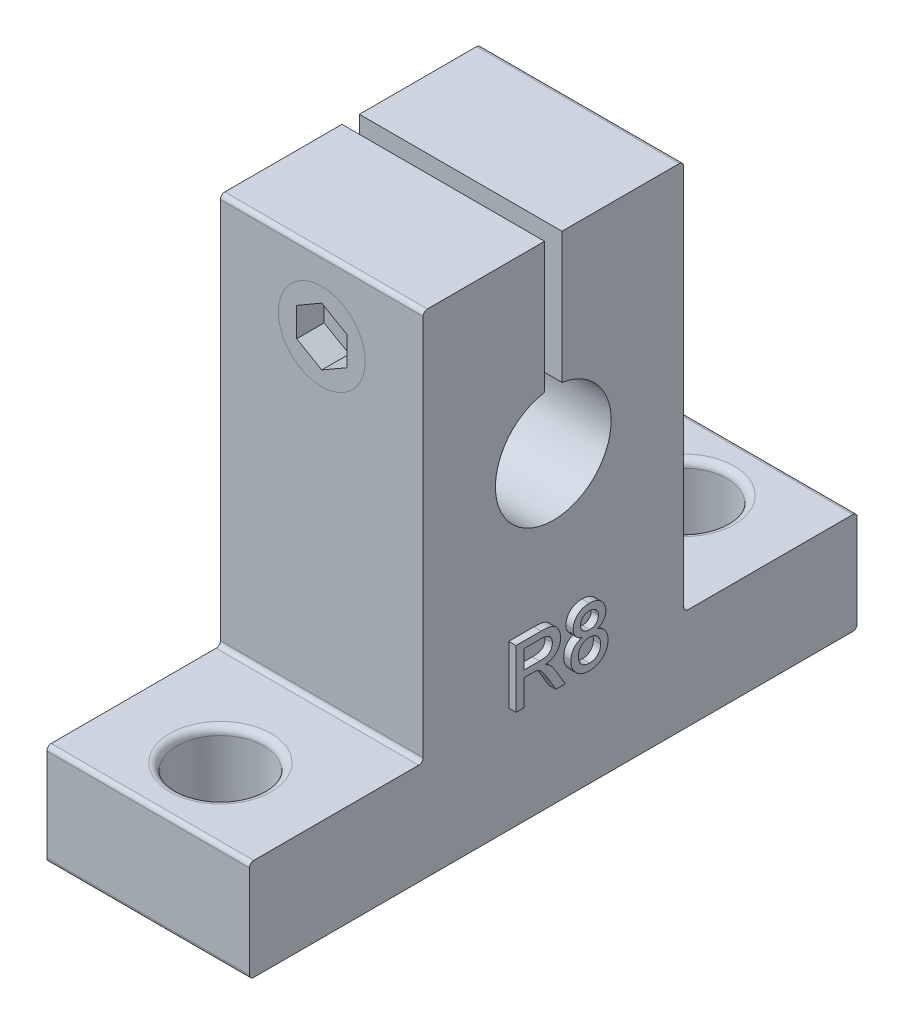
from build123d import *

# Parameters (mm, degrees)
SKETCH_1_R               = 4
EXTRUDE_1_DEPTH          = 14
CUT_EXTRUDE_1_DEPTH      = 56.821142948
CUT_EXTRUDE_1_DEPTH_BACK = 14
SKETCH_2_W               = 1.2
SKETCH_2_H               = 13
SKETCH_3_R               = 3
CUT_EXTRUDE_1_2_DEPTH    = 14
SKETCH_4_R               = 2
CUT_EXTRUDE_2_DEPTH      = 24
SKETCH_5_R               = 3
CUT_EXTRUDE_3_DEPTH      = 5
EXTRUDE_2_DEPTH          = 0.1
EXTRUDE_2_DEPTH_BACK     = 15
SKETCH_6_R               = 2
FILLET_1_R               = 0.5
SKETCH_7_R               = 3
EXTRUDE_3_DEPTH          = 5
FILLET_2_R               = 0.5
FILLET_3_R               = 0.5
EXTRUDE_4_DEPTH          = 0.5


with BuildPart() as part:
    # Эскиз1 → Бобышка-Вытянуть1 (new body)
    with BuildSketch(Plane(origin=(0, 0, 0), x_dir=(0, 0, -1), z_dir=(1, 0, 0))):
        with BuildLine():
            Line((0.3, 7), (11.7, 7))
            ThreePointArc((11.7, 7), (11.912132034, 7.087867966), (12, 7.3))
            Line((12, 7.3), (12, 33.7))
            ThreePointArc((12, 33.7), (12.087867966, 33.912132034), (12.3, 34))
            Line((12.3, 34), (29.7, 34))
            ThreePointArc((29.7, 34), (29.912132034, 33.912132034), (30, 33.7))
            Line((30, 33.7), (30, 7.3))
            ThreePointArc((30, 7.3), (30.087867966, 7.087867966), (30.3, 7))
            Line((30.3, 7), (41.7, 7))
            ThreePointArc((41.7, 7), (41.912132034, 6.912132034), (42, 6.7))
            Line((42, 6.7), (42, 0.3))
            ThreePointArc((42, 0.3), (41.912132034, 0.087867966), (41.7, 0))
            Line((41.7, 0), (0.3, 0))
            ThreePointArc((0.3, 0), (0.087867966, 0.087867966), (0, 0.3))
            Line((0, 0.3), (0, 6.7))
            ThreePointArc((0, 6.7), (0.087867966, 6.912132034), (0.3, 7))
        make_face()
        with Locations((21, 21)):
            Circle(SKETCH_1_R, mode=Mode.SUBTRACT)
    extrude(amount=EXTRUDE_1_DEPTH)

    # Эскиз2 → Cut-Extrude 1 (cut, two sides: drawn at the far end of the back side and taken through both)
    with BuildSketch(Plane(origin=(14, 0, 0), x_dir=(0, 0, -1), z_dir=(1, 0, 0)).offset(-CUT_EXTRUDE_1_DEPTH_BACK)):
        with Locations((21, 27.5)):
            Rectangle(SKETCH_2_W, SKETCH_2_H)
    extrude(amount=CUT_EXTRUDE_1_DEPTH + CUT_EXTRUDE_1_DEPTH_BACK, mode=Mode.SUBTRACT)

    # Эскиз3 → Cut-Extrude 1 2 (cut)
    with BuildSketch(Plane(origin=(0, 7, 0), x_dir=(1, 0, 0), z_dir=(0, 1, 0))):
        with Locations(Location((7, 5, 0), (0, 0, 270))):
            Circle(SKETCH_3_R)
        with Locations(Location((7, 37, 0), (0, 0, 270))):
            Circle(SKETCH_3_R)
    extrude(amount=-CUT_EXTRUDE_1_2_DEPTH, mode=Mode.SUBTRACT)

    # Эскиз4 → Вырез-Вытянуть2 (cut)
    with BuildSketch(Plane.XY.offset(-12)):
        with Locations((7, 29)):
            Circle(SKETCH_4_R)
    extrude(amount=-CUT_EXTRUDE_2_DEPTH, mode=Mode.SUBTRACT)

    # Эскиз5 → Вырез-Вытянуть3 (cut)
    with BuildSketch(Plane.XY.offset(-12)):
        with Locations((7, 29)):
            Circle(SKETCH_5_R)
    extrude(amount=-CUT_EXTRUDE_3_DEPTH, mode=Mode.SUBTRACT)

    # Скругление1
    fillet_1_edges = [part.edges().sort_by_distance(p)[0] for p in [
        (5, 29, -30),
    ]]
    fillet(fillet_1_edges, radius=FILLET_1_R)

    # Скругление2
    fillet_2_edges = [part.edges().sort_by_distance(p)[0] for p in [
        (7, 7, -8),
    ]]
    fillet(fillet_2_edges, radius=FILLET_2_R)

    # Скругление3
    fillet_3_edges = [part.edges().sort_by_distance(p)[0] for p in [
        (7, 7, -40),
    ]]
    fillet(fillet_3_edges, radius=FILLET_3_R)

    # Эскиз8 → Бобышка-Вытянуть4 (add)
    # profile 1 of 2: a face of its own
    with BuildSketch(Plane(origin=(14, 0, 0), x_dir=(0, 0, -1), z_dir=(1, 0, 0))):
        with BuildLine():
            Line((17.923076923, 7.3), (17.923076923, 11.3))
            Line((17.923076923, 11.3), (19.658653846, 11.3))
            add(Edge.make_bspline(
                [(19.658653846, 11.3), (19.699521368, 11.299679786), (19.778615674, 11.299060049), (19.893318749, 11.294673018), (20.00038257, 11.285215729), (20.100003993, 11.274988989), (20.192165317, 11.259292309), (20.276771462, 11.241288572), (20.353953055, 11.219863853), (20.424055146, 11.194559608), (20.4890946, 11.165931645), (20.549381261, 11.130609361), (20.607421168, 11.091903669), (20.661060257, 11.046430258), (20.711713265, 10.996641081), (20.759333246, 10.941859611), (20.803215222, 10.881610454), (20.857338384, 10.795381416), (20.915401502, 10.680542495), (20.9637772, 10.53357356), (20.994968984, 10.37983869), (20.998306594, 10.274778715), (21, 10.221474359)],
                knots=[0, 0, 0, 0, 1.242255013, 2.404239178, 3.487702428, 4.508875116, 5.447164253, 6.327763259, 7.137389581, 7.87956647, 8.591787438, 9.293660819, 10.000726923, 10.709654955, 11.427269343, 12.158170644, 12.913245971, 13.690346794, 15.251572448, 16.809945773, 18.381459854, 20, 20, 20, 20], degree=3))
            add(Edge.make_bspline(
                [(21, 10.221474359), (20.999217269, 10.187257716), (20.997671323, 10.1196775), (20.985829218, 10.020316493), (20.964401885, 9.925381047), (20.936925554, 9.834039733), (20.899318838, 9.747586712), (20.855753091, 9.664256155), (20.801781324, 9.586337375), (20.741353962, 9.511755519), (20.672059983, 9.442107932), (20.593289808, 9.379907326), (20.505824269, 9.323957758), (20.409251438, 9.275802895), (20.304682964, 9.231787065), (20.190806802, 9.196343398), (20.068082545, 9.167400926), (19.983004386, 9.153385864), (19.939102564, 9.146153846)],
                knots=[0, 0, 0, 0, 0.982609109, 1.940720374, 2.867584677, 3.775009516, 4.675469332, 5.571146231, 6.471115823, 7.392408543, 8.32534739, 9.286126426, 10.269214477, 11.301811357, 12.381622301, 13.524260118, 14.722474812, 16, 16, 16, 16], degree=3))
            add(Edge.make_bspline(
                [(19.939102564, 9.146153846), (19.971306214, 9.129885273), (20.032462104, 9.098990666), (20.117133191, 9.050548191), (20.188905941, 9.001051919), (20.230487532, 8.96565073), (20.25, 8.949038462)],
                knots=[0, 0, 0, 0, 1.172304973, 2.226249348, 3.167654437, 4, 4, 4, 4], degree=3))
            add(Edge.make_bspline(
                [(20.25, 8.949038462), (20.287786997, 8.911996162), (20.365404172, 8.835908648), (20.472364011, 8.706309322), (20.576065249, 8.562045386), (20.639071569, 8.457785351), (20.671474359, 8.404166667)],
                knots=[0, 0, 0, 0, 0.918110279, 1.885863737, 2.912745394, 4, 4, 4, 4], degree=3))
            Line((20.671474359, 8.404166667), (21.327724359, 7.3))
            Line((21.327724359, 7.3), (20.681089744, 7.3))
            Line((20.681089744, 7.3), (20.182692308, 8.144551282))
            add(Edge.make_bspline(
                [(20.182692308, 8.144551282), (20.164772439, 8.174183379), (20.130046677, 8.231605517), (20.079886557, 8.315467786), (20.030706209, 8.392676366), (19.985092277, 8.465437921), (19.941193672, 8.532431501), (19.899434556, 8.593889829), (19.860964161, 8.650619156), (19.813313602, 8.716666857), (19.757856265, 8.789749251), (19.693141359, 8.865010316), (19.631513581, 8.925014961), (19.555617835, 8.983855898), (19.461609471, 9.038891704), (19.381700587, 9.064179145), (19.342948718, 9.076442308)],
                knots=[0, 0, 0, 0, 1.130940588, 2.191577161, 3.191089816, 4.120344442, 4.99615009, 5.80661983, 6.546979556, 7.234477901, 8.466216387, 9.541989141, 10.473533583, 11.269175393, 12.675684693, 14, 14, 14, 14], degree=3))
            add(Edge.make_bspline(
                [(19.342948718, 9.076442308), (19.32668987, 9.079374331), (19.289570432, 9.086068227), (19.22654172, 9.090440021), (19.150174703, 9.095080096), (19.094830224, 9.094944899), (19.064903846, 9.094871795)],
                knots=[0, 0, 0, 0, 0.709978628, 1.620902492, 2.713552433, 4, 4, 4, 4], degree=3))
            Line((19.064903846, 9.094871795), (18.487179487, 9.094871795))
            Line((18.487179487, 9.094871795), (18.487179487, 7.3))
            Line((18.487179487, 7.3), (17.923076923, 7.3))
        make_face()
        with BuildLine():
            Line((18.487179487, 9.556410256), (19.55849359, 9.556410256))
            add(Edge.make_bspline(
                [(19.55849359, 9.556410256), (19.612213337, 9.557250753), (19.712637365, 9.558821982), (19.853064483, 9.572238628), (19.972739631, 9.593558247), (20.074028619, 9.624655409), (20.159127356, 9.667828597), (20.233139345, 9.720443194), (20.294644239, 9.786348453), (20.345809958, 9.860708507), (20.385582121, 9.942538035), (20.414271862, 10.028487956), (20.433049797, 10.117835918), (20.434939816, 10.178644903), (20.435897436, 10.209455128)],
                knots=[0, 0, 0, 0, 1.546323217, 2.890706218, 4.056530419, 5.041445823, 5.928701482, 6.793137403, 7.641659452, 8.509781392, 9.383301667, 10.251423607, 11.114044887, 12, 12, 12, 12], degree=3))
            add(Edge.make_bspline(
                [(20.435897436, 10.209455128), (20.435152926, 10.231907711), (20.433694651, 10.275885724), (20.426049887, 10.340433237), (20.411186652, 10.401768295), (20.391559786, 10.46021512), (20.365334311, 10.515345632), (20.334179516, 10.567587031), (20.297002227, 10.616649775), (20.254417783, 10.662683315), (20.205523102, 10.704569339), (20.149673881, 10.740707892), (20.087310601, 10.771417866), (20.018360773, 10.795791354), (19.943041602, 10.815286177), (19.860924314, 10.828255454), (19.772384447, 10.83763998), (19.711031453, 10.838182569), (19.679487179, 10.838461538)],
                knots=[0, 0, 0, 0, 0.965208469, 1.890559848, 2.786986821, 3.67262109, 4.535197034, 5.405224191, 6.282113641, 7.175449223, 8.095446547, 9.040936516, 10.026471658, 11.075712529, 12.17809725, 13.364958037, 14.645208957, 16, 16, 16, 16], degree=3))
            Line((19.679487179, 10.838461538), (18.487179487, 10.838461538))
            Line((18.487179487, 10.838461538), (18.487179487, 9.556410256))
        make_face(mode=Mode.SUBTRACT)
    # profile 2 of 2: a face of its own
    with BuildSketch(Plane(origin=(14, 0, 0), x_dir=(0, 0, -1), z_dir=(1, 0, 0))):
        with BuildLine():
            add(Edge.make_bspline(
                [(22.477564103, 9.493910256), (22.428906491, 9.512945389), (22.335613715, 9.549442052), (22.209785813, 9.622482146), (22.103292606, 9.706505156), (22.017441691, 9.803537241), (21.952007686, 9.911572483), (21.904892615, 10.029233436), (21.877296492, 10.157175602), (21.873664523, 10.245644314), (21.871794872, 10.291185897)],
                knots=[0, 0, 0, 0, 1.16287356, 2.229614231, 3.228817875, 4.173350329, 5.100165549, 6.029633206, 6.985702163, 8, 8, 8, 8], degree=3))
            add(Edge.make_bspline(
                [(21.871794872, 10.291185897), (21.872674829, 10.326228138), (21.874402214, 10.395017151), (21.889327207, 10.495953381), (21.913231735, 10.592675543), (21.947157852, 10.684910647), (21.989661717, 10.773417872), (22.043294426, 10.856575728), (22.104941895, 10.936734422), (22.177158974, 11.010653698), (22.256740948, 11.0783566), (22.342940644, 11.138605534), (22.436417665, 11.187874514), (22.535613483, 11.229067534), (22.641018571, 11.261317312), (22.753004223, 11.283281208), (22.871175665, 11.297251876), (22.952149544, 11.299069692), (22.993589744, 11.3)],
                knots=[0, 0, 0, 0, 0.994101948, 1.951453197, 2.889123786, 3.817215529, 4.736003873, 5.669743943, 6.620499649, 7.601567446, 8.596478358, 9.582687259, 10.579761808, 11.589151689, 12.62747492, 13.702346593, 14.8241243, 16, 16, 16, 16], degree=3))
            add(Edge.make_bspline(
                [(22.993589744, 11.3), (23.035294004, 11.299060246), (23.116529199, 11.297229712), (23.235328462, 11.283446756), (23.348020816, 11.260345664), (23.454539914, 11.227571029), (23.555053686, 11.185666686), (23.648901658, 11.134160747), (23.737049936, 11.073902709), (23.817245482, 11.004173975), (23.890213869, 10.928471244), (23.953434085, 10.847367996), (24.007656052, 10.762756721), (24.052462361, 10.674123384), (24.085610237, 10.580458689), (24.11087636, 10.483527323), (24.125531883, 10.382177553), (24.127302929, 10.313401184), (24.128205128, 10.278365385)],
                knots=[0, 0, 0, 0, 1.171211919, 2.281388661, 3.353996503, 4.398126828, 5.406889753, 6.407389155, 7.400009931, 8.40008733, 9.387021643, 10.349004252, 11.283445052, 12.206096336, 13.131640667, 14.068727932, 15.016178647, 16, 16, 16, 16], degree=3))
            add(Edge.make_bspline(
                [(24.128205128, 10.278365385), (24.126739533, 10.234393423), (24.123865776, 10.148172678), (24.094580907, 10.023884758), (24.048937934, 9.907855754), (23.982970065, 9.80229698), (23.899424213, 9.706118248), (23.795750473, 9.622509022), (23.673523319, 9.549583078), (23.582586038, 9.512967412), (23.53525641, 9.493910256)],
                knots=[0, 0, 0, 0, 0.998680737, 1.958225066, 2.887911823, 3.823713378, 4.77537694, 5.772726054, 6.840782926, 8, 8, 8, 8], degree=3))
            add(Edge.make_bspline(
                [(23.53525641, 9.493910256), (23.565118333, 9.483773549), (23.623634746, 9.463909999), (23.706359495, 9.425289138), (23.78424236, 9.383646681), (23.85772253, 9.338568697), (23.924087672, 9.286702843), (23.985551922, 9.231115732), (24.041856857, 9.171024032), (24.092233411, 9.105916656), (24.137209413, 9.037160099), (24.175712441, 8.964586727), (24.208412323, 8.889229528), (24.236358768, 8.810739056), (24.256771437, 8.728562434), (24.271053908, 8.643077307), (24.280115734, 8.554734211), (24.281399391, 8.49473351), (24.282051282, 8.464262821)],
                knots=[0, 0, 0, 0, 1.104208047, 2.163768705, 3.193778962, 4.198696312, 5.179575955, 6.14024585, 7.100368562, 8.060719304, 9.021161243, 9.975749006, 10.935506756, 11.897452199, 12.89163552, 13.897859372, 14.932451246, 16, 16, 16, 16], degree=3))
            add(Edge.make_bspline(
                [(24.282051282, 8.464262821), (24.281032161, 8.422265957), (24.279024414, 8.339528935), (24.261383721, 8.218080696), (24.234692571, 8.101413091), (24.195773793, 7.990018966), (24.146064845, 7.883819577), (24.084574274, 7.782969135), (24.011906247, 7.687571385), (23.930204345, 7.597329799), (23.838861666, 7.515755314), (23.740045808, 7.443870193), (23.633386001, 7.383657239), (23.520176392, 7.33380113), (23.399874896, 7.29516283), (23.272636151, 7.268107827), (23.138502497, 7.251997764), (23.04678606, 7.249825868), (23, 7.248717949)],
                knots=[0, 0, 0, 0, 1.017598406, 2.004746413, 2.969099523, 3.915171376, 4.859468899, 5.806714415, 6.772805022, 7.762836953, 8.753334612, 9.736396794, 10.719437652, 11.716790048, 12.730404696, 13.776887535, 14.865953843, 16, 16, 16, 16], degree=3))
            add(Edge.make_bspline(
                [(23, 7.248717949), (22.95321862, 7.249849745), (22.861511356, 7.252068448), (22.727255152, 7.267849166), (22.600198453, 7.296130644), (22.480053378, 7.334808219), (22.366168178, 7.383314468), (22.260224693, 7.444884173), (22.160763372, 7.51667822), (22.069357181, 7.598757267), (21.986976622, 7.688989227), (21.91526652, 7.785795854), (21.854140987, 7.887687326), (21.803835999, 7.995238029), (21.765492128, 8.108448942), (21.738581944, 8.226895033), (21.72090932, 8.350485789), (21.718949491, 8.434819954), (21.717948718, 8.477884615)],
                knots=[0, 0, 0, 0, 1.127066097, 2.209429196, 3.250843736, 4.258219581, 5.246860502, 6.227045772, 7.204057202, 8.19754525, 9.181483529, 10.142920909, 11.095356922, 12.039670968, 12.998174893, 13.969127444, 14.962948905, 16, 16, 16, 16], degree=3))
            add(Edge.make_bspline(
                [(21.717948718, 8.477884615), (21.718644331, 8.50994946), (21.720009244, 8.572866234), (21.728347033, 8.66514802), (21.744964088, 8.753102263), (21.766367914, 8.837247274), (21.793544075, 8.917793564), (21.827071042, 8.994108601), (21.867747891, 9.066007939), (21.913959458, 9.133959426), (21.966288882, 9.197486016), (22.023888022, 9.256031394), (22.086966106, 9.308929645), (22.154105656, 9.357725767), (22.228120922, 9.398968064), (22.3062593, 9.436815556), (22.389864196, 9.469092449), (22.448038028, 9.485554804), (22.477564103, 9.493910256)],
                knots=[0, 0, 0, 0, 1.117345089, 2.192424383, 3.22371675, 4.232639188, 5.215561493, 6.182180952, 7.132172269, 8.089790513, 9.041830748, 9.996006267, 10.94686322, 11.907506267, 12.882866327, 13.894317773, 14.931262935, 16, 16, 16, 16], degree=3))
        make_face()
        with BuildLine():
            add(Edge.make_bspline(
                [(22.384615385, 10.288782051), (22.38613743, 10.247957943), (22.389078697, 10.169067655), (22.421065291, 10.057009782), (22.471083042, 9.956350386), (22.529720076, 9.883354523), (22.585938266, 9.833618665), (22.632860088, 9.800411801), (22.684136565, 9.772219843), (22.740139173, 9.750307276), (22.799511524, 9.730894105), (22.864301288, 9.720043554), (22.93298562, 9.711222701), (22.980468701, 9.710583866), (23.004807692, 9.71025641)],
                knots=[0, 0, 0, 0, 1.528727296, 2.954179336, 4.335216052, 5.725683216, 6.435919001, 7.148062981, 7.879427438, 8.626027458, 9.402978632, 10.2190538, 11.08711833, 12, 12, 12, 12], degree=3))
            add(Edge.make_bspline(
                [(23.004807692, 9.71025641), (23.028609423, 9.710595966), (23.075021496, 9.711258082), (23.142158893, 9.719899104), (23.205603499, 9.731440002), (23.26441779, 9.748928458), (23.319280772, 9.771668553), (23.369300124, 9.799701475), (23.415972665, 9.831919348), (23.470539373, 9.882035185), (23.52909549, 9.952474445), (23.579280862, 10.048637241), (23.61055425, 10.153845052), (23.613746226, 10.227128424), (23.615384615, 10.26474359)],
                knots=[0, 0, 0, 0, 0.922112375, 1.798068639, 2.620552757, 3.419964248, 4.17189205, 4.918165909, 5.639229138, 6.36503528, 7.785020832, 9.165298717, 10.544993853, 12, 12, 12, 12], degree=3))
            add(Edge.make_bspline(
                [(23.615384615, 10.26474359), (23.613410586, 10.303673675), (23.609547922, 10.379849771), (23.578350926, 10.48920399), (23.52582805, 10.588246254), (23.465827945, 10.660575417), (23.410295954, 10.712973636), (23.362785505, 10.746328613), (23.311711595, 10.774716648), (23.256879837, 10.797899301), (23.19821094, 10.816596351), (23.135545979, 10.828862517), (23.069148271, 10.837465211), (23.023534416, 10.838122441), (23, 10.838461538)],
                knots=[0, 0, 0, 0, 1.480633456, 2.897216237, 4.289382554, 5.720567045, 6.454675042, 7.191244726, 7.924224627, 8.676083236, 9.454506446, 10.26432127, 11.104478565, 12, 12, 12, 12], degree=3))
            add(Edge.make_bspline(
                [(23, 10.838461538), (22.976462965, 10.838133408), (22.930578664, 10.837493734), (22.863747996, 10.828632891), (22.80048916, 10.817503851), (22.741385758, 10.799643803), (22.686683465, 10.776304871), (22.635810913, 10.747900891), (22.588390484, 10.715397915), (22.532468343, 10.665336216), (22.473899113, 10.59489536), (22.422301269, 10.500268397), (22.390412132, 10.397093072), (22.386571567, 10.325332907), (22.384615385, 10.288782051)],
                knots=[0, 0, 0, 0, 0.914830409, 1.783417199, 2.618873138, 3.411020283, 4.179090249, 4.927874451, 5.674348476, 6.410336976, 7.841713217, 9.213201474, 10.580551314, 12, 12, 12, 12], degree=3))
        make_face(mode=Mode.SUBTRACT)
        with BuildLine():
            add(Edge.make_bspline(
                [(22.230769231, 8.4875), (22.231656013, 8.454594627), (22.233431914, 8.388697204), (22.249010385, 8.290825565), (22.275443824, 8.194776475), (22.309322877, 8.100459209), (22.357111389, 8.011680576), (22.42048433, 7.932439115), (22.500005501, 7.865817672), (22.590823027, 7.809533349), (22.689928297, 7.765232746), (22.793198887, 7.734309419), (22.897969435, 7.713876829), (22.968656709, 7.711463354), (23.00400641, 7.71025641)],
                knots=[0, 0, 0, 0, 0.957879255, 1.91828174, 2.876792425, 3.856375228, 4.831004356, 5.799187063, 6.79220414, 7.836856316, 8.902268238, 9.943090861, 10.971368942, 12, 12, 12, 12], degree=3))
            add(Edge.make_bspline(
                [(23.00400641, 7.71025641), (23.033156051, 7.710750184), (23.089785494, 7.711709445), (23.17233349, 7.722671064), (23.250112366, 7.739303425), (23.323478461, 7.762109118), (23.391351908, 7.793308815), (23.454837998, 7.829774485), (23.51328735, 7.873846038), (23.566683418, 7.924142805), (23.614482365, 7.979780455), (23.655428207, 8.039801322), (23.691145749, 8.102517467), (23.720307489, 8.169282401), (23.741396127, 8.240233799), (23.75766899, 8.314091543), (23.767485926, 8.391617437), (23.768640725, 8.444469592), (23.769230769, 8.471474359)],
                knots=[0, 0, 0, 0, 1.149387474, 2.232932207, 3.278773642, 4.285224938, 5.256757121, 6.220082341, 7.168479488, 8.137608443, 9.109140627, 10.056190326, 10.999892409, 11.953252726, 12.923240661, 13.915357002, 14.934853301, 16, 16, 16, 16], degree=3))
            add(Edge.make_bspline(
                [(23.769230769, 8.471474359), (23.768621934, 8.499009198), (23.767429931, 8.552918026), (23.757862475, 8.632145453), (23.740677134, 8.707302614), (23.718576715, 8.779524917), (23.688624327, 8.847555899), (23.652670679, 8.912371045), (23.608642067, 8.972261969), (23.560361182, 9.02926198), (23.505723388, 9.080860165), (23.445386162, 9.12535523), (23.381261727, 9.164651907), (23.311410262, 9.194795777), (23.237370688, 9.218941703), (23.158791256, 9.236486501), (23.075351575, 9.247211169), (23.018195764, 9.24820599), (22.988782051, 9.248717949)],
                knots=[0, 0, 0, 0, 1.065858887, 2.086781919, 3.082735321, 4.047496077, 5.006086125, 5.955204095, 6.910833714, 7.878747924, 8.844339535, 9.812198509, 10.776903849, 11.749116737, 12.749729282, 13.788304076, 14.861809717, 16, 16, 16, 16], degree=3))
            add(Edge.make_bspline(
                [(22.988782051, 9.248717949), (22.960167088, 9.248200896), (22.904072848, 9.24718731), (22.822583423, 9.236401892), (22.745437974, 9.219839067), (22.673315229, 9.195597168), (22.605313432, 9.165304451), (22.542676312, 9.127213527), (22.484286427, 9.083000833), (22.431927379, 9.031611987), (22.38468595, 8.975789728), (22.343840674, 8.915948437), (22.307758014, 8.853476255), (22.280375644, 8.78632324), (22.25719892, 8.716660326), (22.242709802, 8.643135433), (22.232409849, 8.566583932), (22.231324096, 8.514246606), (22.230769231, 8.4875)],
                knots=[0, 0, 0, 0, 1.135239447, 2.225422834, 3.256957183, 4.262780498, 5.240265059, 6.205773948, 7.16638056, 8.141101257, 9.111719309, 10.064571387, 11.014055337, 11.969087385, 12.938082716, 13.92369833, 14.938921288, 16, 16, 16, 16], degree=3))
        make_face(mode=Mode.SUBTRACT)
    extrude(amount=EXTRUDE_4_DEPTH)


with BuildPart() as body_2:
    # Эскиз6 → Бобышка-Вытянуть2 (new, two sides: drawn at the far end of the back side and taken through both)
    with BuildSketch(Plane.XY.offset(-14).offset(-EXTRUDE_2_DEPTH_BACK)):
        with Locations((7, 29)):
            Circle(SKETCH_6_R)
    extrude(amount=EXTRUDE_2_DEPTH + EXTRUDE_2_DEPTH_BACK)


with BuildPart() as body_3:
    # Эскиз7 → Бобышка-Вытянуть3 (new body)
    with BuildSketch(Plane.XY.offset(-17)):
        with Locations((7, 29)):
            Circle(SKETCH_7_R)
        Polygon((7, 27), (8.732050808, 28), (8.732050808, 30), (7, 31), (5.267949192, 30), (5.267949192, 28), align=None, mode=Mode.SUBTRACT)
    extrude(amount=EXTRUDE_3_DEPTH)


solid = Compound([part.part, body_2.part, body_3.part])
